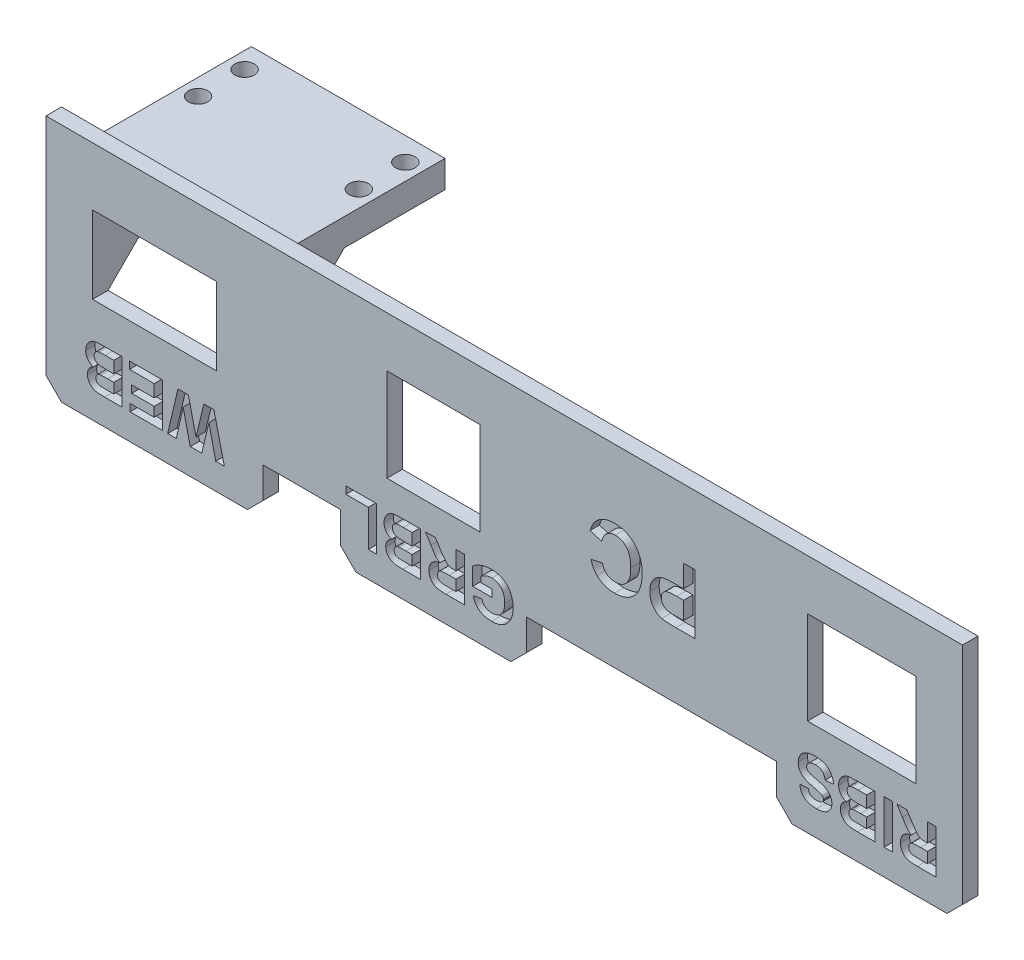
from build123d import *

# Parameters (mm, degrees)
SKETCH_1_W          = 80
SKETCH_1_H          = 25
EXTRUDE_1_DEPTH     = 2
SKETCH_2_W          = 14
SKETCH_2_H          = 12
CUT_EXTRUDE_2_DEPTH = 42.955333392
SKETCH_3_W          = 12
SKETCH_3_H          = 12
CUT_EXTRUDE_3_DEPTH = 42.955333392
SKETCH_4_W          = 40
SKETCH_4_H          = 25
EXTRUDE_2_DEPTH     = 2
SKETCH_5_W          = 16
SKETCH_5_H          = 10
CUT_EXTRUDE_4_DEPTH = 81.995370238
SKETCH_6_W          = 25
SKETCH_6_H          = 3.5
EXTRUDE_3_DEPTH     = 25
CHAMFER_1_SIZE      = 10
SKETCH_7_R          = 1.25
CUT_EXTRUDE_5_DEPTH = 86.060272748
SKETCH_8_W          = 10
SKETCH_8_H          = 12
EXTRUDE_4_DEPTH     = 1.5
SKETCH_9_W          = 2.78
SKETCH_9_H          = 25
EXTRUDE_5_DEPTH     = 2
CUT_EXTRUDE_6_DEPTH = 1.2
SKETCH_12_W         = 24
SKETCH_12_H         = 6
SKETCH_12_W_2       = 32.5
EXTRUDE_6_DEPTH     = 2
SKETCH_13_W         = 4.5
SKETCH_13_H         = 31
CUT_EXTRUDE_7_DEPTH = 89.429511026
CHAMFER_2_SIZE      = 2
SKETCH_14_W         = 1.086596367
SKETCH_14_H         = 5.650301107
CUT_EXTRUDE_9_DEPTH = 1.2


with BuildPart() as part:
    # Эскиз1 → Бобышка-Вытянуть1 (new body)
    with BuildSketch(Plane.XY):
        Rectangle(SKETCH_1_W, SKETCH_1_H)
    extrude(amount=EXTRUDE_1_DEPTH)

    # Эскиз2 → Вырез-Вытянуть2 (cut, through all)
    with BuildSketch(Plane.XY.offset(2)):
        with Locations((27, 0)):
            Rectangle(SKETCH_2_W, SKETCH_2_H)
    extrude(amount=-CUT_EXTRUDE_2_DEPTH, mode=Mode.SUBTRACT)

    # Эскиз3 → Вырез-Вытянуть3 (cut, through all)
    with BuildSketch(Plane(origin=(0, 0, 0), x_dir=(-1, 0, 0), z_dir=(0, 0, -1))):
        with Locations((28.28, 0)):
            Rectangle(SKETCH_3_W, SKETCH_3_H)
    extrude(amount=-CUT_EXTRUDE_3_DEPTH, mode=Mode.SUBTRACT)

    # Эскиз4 → Бобышка-Вытянуть2 (add)
    with BuildSketch(Plane(origin=(0, 0, 0), x_dir=(-1, 0, 0), z_dir=(0, 0, -1))):
        with Locations((60, 0)):
            Rectangle(SKETCH_4_W, SKETCH_4_H)
    extrude(amount=-EXTRUDE_2_DEPTH)

    # Эскиз5 → Вырез-Вытянуть4 (cut, through all)
    with BuildSketch(Plane(origin=(0, 0, 0), x_dir=(-1, 0, 0), z_dir=(0, 0, -1))):
        with Locations((64.28, 0)):
            Rectangle(SKETCH_5_W, SKETCH_5_H)
    extrude(amount=-CUT_EXTRUDE_4_DEPTH, mode=Mode.SUBTRACT)

    # Эскиз6 → Бобышка-Вытянуть3 (add)
    with BuildSketch(Plane.XY.offset(2)):
        with Locations((-64.28, 6.75)):
            Rectangle(SKETCH_6_W, SKETCH_6_H)
    extrude(amount=-EXTRUDE_3_DEPTH)

    # Фаска1
    chamfer_1_edges = [part.edges().sort_by_distance(p)[0] for p in [
        (-74.53, 5, 0),
        (-54.03, 5, 0),
    ]]
    chamfer(chamfer_1_edges, length=CHAMFER_1_SIZE)

    # Эскиз7 → Вырез-Вытянуть5 (cut, through all)
    with BuildSketch(Plane.XZ.offset(-5)):
        with Locations(Location((-53.908844125, -20, 0), (0, 0, 270))):
            Circle(SKETCH_7_R)
        with Locations(Location((-53.908844125, -14, 0), (0, 0, 270))):
            Circle(SKETCH_7_R)
        with Locations(Location((-74.651155875, -20, 0), (0, 0, 270))):
            Circle(SKETCH_7_R)
        with Locations(Location((-74.651155875, -14, 0), (0, 0, 270))):
            Circle(SKETCH_7_R)
    extrude(amount=-CUT_EXTRUDE_5_DEPTH, mode=Mode.SUBTRACT)

    # Эскиз8 → Бобышка-Вытянуть4 (add)
    with BuildSketch(Plane.XZ.offset(-5)):
        with Locations((-64.28, -17)):
            Rectangle(SKETCH_8_W, SKETCH_8_H)
    extrude(amount=EXTRUDE_4_DEPTH)

    # Эскиз9 → Бобышка-Вытянуть5 (add)
    with BuildSketch(Plane(origin=(0, 0, 0), x_dir=(-1, 0, 0), z_dir=(0, 0, -1))):
        with Locations((81.39, 0)):
            Rectangle(SKETCH_9_W, SKETCH_9_H)
    extrude(amount=-EXTRUDE_5_DEPTH)

    # Эскиз11 → Вырез-Вытянуть6 (cut)
    # profile 1 of 2: a face of its own
    with BuildSketch(Plane.XY.offset(2)):
        with BuildLine():
            Line((5.478359688, 3.65174682), (5.478359688, -4.053209235))
            Line((5.478359688, -4.053209235), (3.013452873, -4.053209235))
            add(Edge.make_bspline(
                [(3.013452873, -4.053209235), (2.800429774, -4.054102167), (2.495767017, -4.050088563), (2.109933438, -4.037234048), (1.865932436, -4.025769043), (1.652864321, -4.00880557), (1.428688509, -3.984467149), (1.276000636, -3.960835922), (1.185995347, -3.935906218)],
                knots=[0, 0, 0, 0, 0.348329602, 0.498164033, 0.631257919, 0.747723995, 0.847596688, 1, 1, 1, 1], degree=3))
            add(Edge.make_bspline(
                [(1.185995347, -3.935906218), (1.078043716, -3.908848967), (0.921817825, -3.850736874), (0.724210649, -3.749731505), (0.58450484, -3.659735466), (0.450099086, -3.558951146), (0.323853497, -3.444014248), (0.202732879, -3.316944859), (0.089370641, -3.177364462), (-0.015160121, -3.026091138), (-0.103863958, -2.862113363), (-0.180340645, -2.688294997), (-0.241325119, -2.503526524), (-0.291762845, -2.308893094), (-0.336042582, -2.027769285), (-0.352018509, -1.810614048), (-0.349748097, -1.662388536)],
                knots=[0, 0, 0, 0, 0.112518302, 0.168209323, 0.224431521, 0.280595752, 0.338142129, 0.397105015, 0.458213278, 0.520063291, 0.583016011, 0.646708179, 0.712116041, 0.779846095, 0.850080739, 1, 1, 1, 1], degree=3))
            add(Edge.make_bspline(
                [(-0.349748097, -1.662388536), (-0.352054646, -1.441176961), (-0.32196736, -1.120179825), (-0.213512135, -0.719048285), (-0.098587663, -0.45959524), (0.038546906, -0.227414251), (0.196240904, -0.022832742), (0.367128919, 0.159238307), (0.558273655, 0.309210806), (0.757385329, 0.434443859), (1.020090344, 0.574287736), (1.228617206, 0.644377018), (1.368123716, 0.675954497)],
                knots=[0, 0, 0, 0, 0.210527753, 0.305147016, 0.39443888, 0.479888845, 0.561317318, 0.639975034, 0.71702342, 0.791910697, 0.86378715, 1, 1, 1, 1], degree=3))
            add(Edge.make_bspline(
                [(1.368123716, 0.675954497), (1.470883991, 0.696178212), (1.63318923, 0.722039188), (1.861320537, 0.745033389), (2.055334419, 0.760370918), (2.265297315, 0.772439029), (2.575989609, 0.785703875), (2.816927399, 0.78639883), (2.982583658, 0.787083671)],
                knots=[0, 0, 0, 0, 0.193875999, 0.303996994, 0.424377093, 0.554127776, 0.693295956, 1, 1, 1, 1], degree=3))
            Line((2.982583658, 0.787083671), (3.99663737, 0.787083671))
            Line((3.99663737, 0.787083671), (3.99663737, 3.65174682))
            Line((3.99663737, 3.65174682), (5.478359688, 3.65174682))
        make_face()
        with BuildLine():
            Line((3.99663737, -2.769049892), (3.99663737, -0.497075671))
            Line((3.99663737, -0.497075671), (3.107603979, -0.497075671))
            add(Edge.make_bspline(
                [(3.107603979, -0.497075671), (2.960993299, -0.497150893), (2.750265776, -0.498563845), (2.483485142, -0.515203843), (2.312302846, -0.525612457), (2.162100132, -0.544767202), (2.031014855, -0.565524393), (1.920093975, -0.591332932), (1.799763362, -0.629569014), (1.670425359, -0.690320788), (1.532766574, -0.780334701), (1.412918258, -0.88922142), (1.312378208, -1.015017818), (1.231367858, -1.15415733), (1.153719038, -1.360328039), (1.130127248, -1.526522601), (1.131974221, -1.639236625)],
                knots=[0, 0, 0, 0, 0.168840534, 0.24240189, 0.307726277, 0.366204598, 0.416643548, 0.460461276, 0.497173933, 0.561831686, 0.624256186, 0.685891741, 0.747404803, 0.808969171, 0.870459417, 1, 1, 1, 1], degree=3))
            add(Edge.make_bspline(
                [(1.131974221, -1.639236625), (1.129548484, -1.774466511), (1.161277751, -1.973430835), (1.271105385, -2.212103965), (1.385516429, -2.363602299), (1.523173886, -2.49151677), (1.734268793, -2.631548416), (1.917235008, -2.691543085), (2.042616063, -2.715028766)],
                knots=[0, 0, 0, 0, 0.26321949, 0.386148679, 0.508700935, 0.630747428, 0.750908696, 1, 1, 1, 1], degree=3))
            add(Edge.make_bspline(
                [(2.042616063, -2.715028766), (2.102927461, -2.725673624), (2.203281943, -2.737135235), (2.349673541, -2.748294401), (2.487076841, -2.755864407), (2.642475077, -2.761758664), (2.886319652, -2.768904518), (3.078297819, -2.766806892), (3.21255931, -2.769049892)],
                knots=[0, 0, 0, 0, 0.156655451, 0.258348345, 0.375719036, 0.508809543, 0.656332343, 1, 1, 1, 1], degree=3))
            Line((3.21255931, -2.769049892), (3.99663737, -2.769049892))
        make_face(mode=Mode.SUBTRACT)
    # profile 2 of 2: a face of its own
    with BuildSketch(Plane.XY.offset(2)):
        with BuildLine():
            Line((-6.572981833, 0.787083671), (-8.054704152, 1.280991111))
            add(Edge.make_bspline(
                [(-8.054704152, 1.280991111), (-7.998555008, 1.471937397), (-7.901939419, 1.74952561), (-7.733904011, 2.094337667), (-7.596621706, 2.328520335), (-7.444442512, 2.542527355), (-7.279449225, 2.738528833), (-7.097558543, 2.913276784), (-6.902424044, 3.070007296), (-6.693081544, 3.207871438), (-6.469846422, 3.327081178), (-6.233119624, 3.427352702), (-5.982567665, 3.509162995), (-5.719128813, 3.574418995), (-5.341440611, 3.633622697), (-5.050186697, 3.652644814), (-4.852023099, 3.65174682)],
                knots=[0, 0, 0, 0, 0.137909663, 0.202924781, 0.265376309, 0.325682998, 0.384580708, 0.442536498, 0.500073488, 0.55768655, 0.615868613, 0.675098405, 0.73549134, 0.798229849, 0.862839507, 1, 1, 1, 1], degree=3))
            add(Edge.make_bspline(
                [(-4.852023099, 3.65174682), (-4.605833936, 3.653432427), (-4.242431981, 3.621784584), (-3.777218663, 3.512751465), (-3.450542698, 3.402038406), (-3.141951695, 3.255647882), (-2.85069766, 3.077577526), (-2.577149106, 2.866855295), (-2.321779683, 2.627393834), (-2.090302642, 2.359381453), (-1.88842698, 2.06514326), (-1.716690744, 1.748226115), (-1.577186791, 1.407053928), (-1.469298836, 1.042448075), (-1.364951054, 0.512203552), (-1.337375048, 0.098066776), (-1.337562976, -0.183753139)],
                knots=[0, 0, 0, 0, 0.126041097, 0.185857567, 0.244347414, 0.302332477, 0.360396495, 0.418837069, 0.478854544, 0.539381069, 0.599818648, 0.661238859, 0.723620663, 0.788224015, 0.855653754, 1, 1, 1, 1], degree=3))
            add(Edge.make_bspline(
                [(-1.337562976, -0.183753139), (-1.338134136, -0.480803195), (-1.3635875, -0.91628349), (-1.470036933, -1.472684189), (-1.574430683, -1.854099171), (-1.715383739, -2.207874206), (-1.882239756, -2.537705472), (-2.085559046, -2.838470758), (-2.314512299, -3.113365314), (-2.569929875, -3.357385781), (-2.84596409, -3.570546942), (-3.142048486, -3.749663375), (-3.456676706, -3.89830579), (-3.791381524, -4.011777677), (-4.272536262, -4.123977376), (-4.649515733, -4.149785685), (-4.904500765, -4.151990723)],
                knots=[0, 0, 0, 0, 0.147860689, 0.216120613, 0.281505407, 0.344235521, 0.405240655, 0.465004469, 0.52441051, 0.58287419, 0.640357287, 0.69754568, 0.754672197, 0.813103942, 0.873008409, 1, 1, 1, 1], degree=3))
            add(Edge.make_bspline(
                [(-4.904500765, -4.151990723), (-5.127393192, -4.149925741), (-5.456606652, -4.129217763), (-5.878168646, -4.038847544), (-6.171353118, -3.94541993), (-6.449553196, -3.828831988), (-6.79756799, -3.63335152), (-7.03288123, -3.447423484), (-7.176474986, -3.309261154)],
                knots=[0, 0, 0, 0, 0.269237394, 0.396244931, 0.519356603, 0.640090852, 0.759610598, 1, 1, 1, 1], degree=3))
            add(Edge.make_bspline(
                [(-7.176474986, -3.309261154), (-7.266383249, -3.225080186), (-7.388230548, -3.082671185), (-7.533715345, -2.874487792), (-7.634852934, -2.701884988), (-7.727674712, -2.515527694), (-7.842989812, -2.243504334), (-7.914787063, -2.028576214), (-7.955922664, -1.880016502)],
                knots=[0, 0, 0, 0, 0.223929846, 0.340378238, 0.462188223, 0.58789995, 0.719300613, 1, 1, 1, 1], degree=3))
            Line((-7.955922664, -1.880016502), (-6.474200346, -1.583672038))
            add(Edge.make_bspline(
                [(-6.474200346, -1.583672038), (-6.451567551, -1.679967675), (-6.407071216, -1.819617812), (-6.329002598, -1.996090761), (-6.257658685, -2.116382547), (-6.181939008, -2.231907319), (-6.092081352, -2.336717227), (-5.995730226, -2.436009257), (-5.888715483, -2.525273795), (-5.774106291, -2.605799122), (-5.653058463, -2.676642115), (-5.525275466, -2.735769419), (-5.391724045, -2.783113385), (-5.252847572, -2.822828347), (-5.055522255, -2.856468218), (-4.904041806, -2.87027545), (-4.801088895, -2.86783138)],
                knots=[0, 0, 0, 0, 0.129401266, 0.191502994, 0.252159567, 0.312316653, 0.372084051, 0.432575837, 0.493292221, 0.554213761, 0.615790888, 0.676667726, 0.738244853, 0.801163147, 0.865507532, 1, 1, 1, 1], degree=3))
            add(Edge.make_bspline(
                [(-4.801088895, -2.86783138), (-4.659662948, -2.869536596), (-4.452010551, -2.848751096), (-4.185637873, -2.787178655), (-4.000244187, -2.720132021), (-3.8259999, -2.633006872), (-3.660364725, -2.529513899), (-3.507560848, -2.404619368), (-3.363948463, -2.262443249), (-3.235214471, -2.097195594), (-3.121928697, -1.909536082), (-3.027979937, -1.6971304), (-2.951692941, -1.462120467), (-2.891677026, -1.203934979), (-2.832233093, -0.814248446), (-2.821623824, -0.507539904), (-2.819285294, -0.296425774)],
                knots=[0, 0, 0, 0, 0.114852437, 0.169049484, 0.221994742, 0.274766097, 0.32723799, 0.380498132, 0.434940153, 0.49127413, 0.550405841, 0.612775607, 0.679730962, 0.751082971, 0.828134719, 1, 1, 1, 1], degree=3))
            add(Edge.make_bspline(
                [(-2.819285294, -0.296425774), (-2.821656495, -0.073514331), (-2.831837894, 0.24964009), (-2.891916912, 0.660321296), (-2.950823164, 0.930587638), (-3.027978377, 1.175181859), (-3.122061425, 1.394231942), (-3.232101479, 1.588881923), (-3.362615906, 1.755807611), (-3.505874782, 1.899808111), (-3.658627286, 2.025569561), (-3.822405838, 2.131382832), (-3.995989688, 2.21874272), (-4.180804408, 2.284633362), (-4.444794167, 2.350023092), (-4.651625582, 2.368487523), (-4.79182813, 2.367587477)],
                knots=[0, 0, 0, 0, 0.177674264, 0.256758734, 0.330210817, 0.397712961, 0.460651267, 0.519748378, 0.575225846, 0.628818309, 0.681221634, 0.732470463, 0.783770027, 0.835606603, 0.888367416, 1, 1, 1, 1], degree=3))
            add(Edge.make_bspline(
                [(-4.79182813, 2.367587477), (-4.895914692, 2.366076755), (-5.051285592, 2.358309469), (-5.25116766, 2.31562766), (-5.393614107, 2.273984984), (-5.531146361, 2.22170365), (-5.66166097, 2.154645815), (-5.787727232, 2.077570673), (-5.906729055, 1.98724511), (-6.020259716, 1.885837196), (-6.123807395, 1.768635244), (-6.219852578, 1.638453972), (-6.307196358, 1.494428684), (-6.388678586, 1.337771139), (-6.483919425, 1.102788447), (-6.542632595, 0.916733971), (-6.572981833, 0.787083671)],
                knots=[0, 0, 0, 0, 0.12046088, 0.178740623, 0.235724111, 0.291792154, 0.348405626, 0.404978529, 0.462271107, 0.520759571, 0.580529381, 0.642578218, 0.707405436, 0.774920301, 0.846330275, 1, 1, 1, 1], degree=3))
        make_face()
    extrude(amount=-CUT_EXTRUDE_6_DEPTH, mode=Mode.SUBTRACT)

    # Эскиз12 → Бобышка-Вытянуть6 (add)
    with BuildSketch(Plane.XY.offset(2)):
        with Locations((28, -15.5)):
            Rectangle(SKETCH_12_W, SKETCH_12_H)
        with Locations((-28.28, -15.5)):
            Rectangle(SKETCH_12_W, SKETCH_12_H)
        with Locations((-66.53, -15.5)):
            Rectangle(SKETCH_12_W_2, SKETCH_12_H)
    extrude(amount=-EXTRUDE_6_DEPTH)

    # Эскиз13 → Вырез-Вытянуть7 (cut, through all)
    with BuildSketch(Plane.XY.offset(2)):
        with Locations((-80.53, -3)):
            Rectangle(SKETCH_13_W, SKETCH_13_H)
    extrude(amount=-CUT_EXTRUDE_7_DEPTH, mode=Mode.SUBTRACT)

    # Фаска2
    chamfer_2_edges = [part.edges().sort_by_distance(p)[0] for p in [
        (40, -18.5, 1),
        (16, -18.5, 1),
        (-16.28, -18.5, 1),
        (-40.28, -18.5, 1),
        (-50.28, -18.5, 1),
        (-78.28, -18.5, 1),
    ]]
    chamfer(chamfer_2_edges, length=CHAMFER_2_SIZE)

    # Эскиз14 → Вырез-Вытянуть9 (cut)
    # profile 1 of 11: a face of its own
    with BuildSketch(Plane.XY.offset(2)):
        with BuildLine():
            add(Edge.make_bspline(
                [(33.623136198, -10.782410087), (33.693264238, -10.880716199), (33.794851378, -11.020131193), (33.924541243, -11.195689492), (34.009369637, -11.303989592), (34.081658422, -11.399947587), (34.147951096, -11.478438876), (34.202905755, -11.544130526), (34.265318059, -11.609047013), (34.337307856, -11.676257131), (34.428085748, -11.738872839), (34.518411937, -11.79296373), (34.617767695, -11.831854256), (34.732335598, -11.859139845), (34.933692452, -11.885127943), (35.098900311, -11.891927393), (35.21794274, -11.890512007)],
                knots=[0, 0, 0, 0, 0.174866002, 0.249830473, 0.31605822, 0.374090993, 0.423761052, 0.464830962, 0.498066322, 0.55415278, 0.607062015, 0.657483699, 0.706286701, 0.760884302, 0.827646316, 1, 1, 1, 1], degree=3))
            Line((35.21794274, -11.890512007), (35.461295051, -11.890512007))
            Line((35.461295051, -11.890512007), (35.461295051, -9.5))
            Line((35.461295051, -9.5), (36.547891418, -9.5))
            Line((36.547891418, -9.5), (36.547891418, -15.150301107))
            Line((36.547891418, -15.150301107), (34.176621222, -15.150301107))
            add(Edge.make_bspline(
                [(34.176621222, -15.150301107), (34.037789594, -15.149590871), (33.836718593, -15.147853525), (33.579591916, -15.12967221), (33.40915453, -15.114902728), (33.253998612, -15.093181259), (33.113752443, -15.067677632), (32.988868067, -15.037536073), (32.877968317, -15.00204931), (32.77724231, -14.960475907), (32.68308223, -14.911999922), (32.59459821, -14.854772129), (32.510630246, -14.791196088), (32.430852387, -14.721101628), (32.357443785, -14.642653295), (32.289127655, -14.557013922), (32.225958462, -14.464897483), (32.17031058, -14.36671033), (32.119462302, -14.265605868), (32.078072502, -14.16050819), (32.043875078, -14.051912294), (32.016594907, -13.940054325), (31.990868175, -13.784395152), (31.98367804, -13.665118725), (31.984186678, -13.584923216)],
                knots=[0, 0, 0, 0, 0.134564938, 0.19465053, 0.249721971, 0.300282227, 0.346384104, 0.387788665, 0.424666182, 0.459084619, 0.493255628, 0.52712418, 0.561047925, 0.595230664, 0.629883197, 0.664993531, 0.701292162, 0.737973481, 0.774266589, 0.810854894, 0.847272973, 0.884511088, 0.922311938, 1, 1, 1, 1], degree=3))
            add(Edge.make_bspline(
                [(31.984186678, -13.584923216), (31.983471904, -13.48446665), (31.995631106, -13.336632207), (32.031221358, -13.145210984), (32.071364491, -13.011746908), (32.121351736, -12.884693027), (32.182405499, -12.764940092), (32.254463943, -12.651365665), (32.337892518, -12.545575358), (32.432357921, -12.447356341), (32.538392622, -12.358853898), (32.655296385, -12.279146116), (32.784024439, -12.210605183), (32.922363535, -12.150237929), (33.127170658, -12.082208643), (33.289461433, -12.048309577), (33.401289439, -12.030864037)],
                knots=[0, 0, 0, 0, 0.129370558, 0.190806849, 0.250676869, 0.308757523, 0.366623905, 0.423703961, 0.481896537, 0.540034196, 0.599076462, 0.659653679, 0.722117385, 0.786819453, 0.854039683, 1, 1, 1, 1], degree=3))
            add(Edge.make_bspline(
                [(33.401289439, -12.030864037), (33.29184529, -11.961890264), (33.138102391, -11.848887333), (32.954615766, -11.681189197), (32.851418679, -11.571990133), (32.774959986, -11.474206233), (32.71085207, -11.390469506), (32.643183233, -11.292843502), (32.571641967, -11.181819562), (32.492677415, -11.059589815), (32.378793253, -10.870914564), (32.292584175, -10.722073257), (32.234330216, -10.618288761)],
                knots=[0, 0, 0, 0, 0.209166393, 0.307622323, 0.401732901, 0.45166098, 0.508279267, 0.572256002, 0.643666983, 0.721858097, 0.807553445, 1, 1, 1, 1], degree=3))
            Line((32.234330216, -10.618288761), (31.549548131, -9.5))
            Line((31.549548131, -9.5), (32.819507635, -9.5))
            Line((32.819507635, -9.5), (33.623136198, -10.782410087))
        make_face()
        with BuildLine():
            add(Edge.make_bspline(
                [(33.674070402, -14.190474316), (33.709751387, -14.19518118), (33.772854372, -14.197960003), (33.868717722, -14.202427006), (33.967981766, -14.204055127), (34.08492673, -14.206809204), (34.276983894, -14.207599964), (34.429775731, -14.209524633), (34.53768814, -14.208584256)],
                knots=[0, 0, 0, 0, 0.124812716, 0.219210218, 0.333205091, 0.469464021, 0.625352362, 1, 1, 1, 1], degree=3))
            Line((34.53768814, -14.208584256), (35.461295051, -14.208584256))
            Line((35.461295051, -14.208584256), (35.461295051, -12.832228858))
            Line((35.461295051, -12.832228858), (34.586358602, -12.832228858))
            add(Edge.make_bspline(
                [(34.586358602, -12.832228858), (34.457667678, -12.831499045), (34.274705981, -12.835205134), (34.044091857, -12.83999342), (33.901139257, -12.848653048), (33.778020129, -12.85692838), (33.674890065, -12.867969485), (33.591613238, -12.880930527), (33.508439667, -12.901096453), (33.42321261, -12.936204286), (33.332498089, -12.986309449), (33.254325563, -13.051134432), (33.188435117, -13.127167027), (33.135568134, -13.214252379), (33.083845988, -13.348904605), (33.071348179, -13.459715198), (33.070783045, -13.535120883)],
                knots=[0, 0, 0, 0, 0.20221285, 0.287630068, 0.362456521, 0.427261522, 0.481544462, 0.525410475, 0.559637404, 0.615792278, 0.669701509, 0.721934669, 0.774479892, 0.82715543, 0.881220959, 1, 1, 1, 1], degree=3))
            add(Edge.make_bspline(
                [(33.070783045, -13.535120883), (33.071072813, -13.618892461), (33.087779732, -13.742330247), (33.155199373, -13.889039749), (33.22567018, -13.980801575), (33.314564099, -14.057525593), (33.460222862, -14.142180121), (33.586617177, -14.176416722), (33.674070402, -14.190474316)],
                knots=[0, 0, 0, 0, 0.256156175, 0.373042872, 0.488836402, 0.606316624, 0.729101171, 1, 1, 1, 1], degree=3))
        make_face(mode=Mode.SUBTRACT)
    # profile 2 of 11: a face of its own
    with BuildSketch(Plane.XY.offset(2)):
        with Locations((30.426731886, -12.325150554)):
            Rectangle(SKETCH_14_W, SKETCH_14_H)
    # profile 3 of 11: a face of its own
    with BuildSketch(Plane.XY.offset(2)):
        with BuildLine():
            add(Edge.make_bspline(
                [(25.441971053, -9.538483621), (25.506018808, -9.532795804), (25.614631221, -9.525032759), (25.776239683, -9.518934376), (25.93467947, -9.512913697), (26.118437414, -9.508590439), (26.413486657, -9.504344015), (26.647397939, -9.500505031), (26.811535224, -9.5)],
                knots=[0, 0, 0, 0, 0.140766497, 0.238315848, 0.354022328, 0.487866729, 0.640687248, 1, 1, 1, 1], degree=3))
            Line((26.811535224, -9.5), (28.724397578, -9.5))
            Line((28.724397578, -9.5), (28.724397578, -15.150301107))
            Line((28.724397578, -15.150301107), (26.448204564, -15.150301107))
            add(Edge.make_bspline(
                [(26.448204564, -15.150301107), (26.342571182, -15.149428256), (26.189322791, -15.149403758), (25.992413541, -15.142641098), (25.860689569, -15.137401866), (25.739901518, -15.129669187), (25.629751335, -15.119275729), (25.530496382, -15.108057838), (25.413073866, -15.092396114), (25.277554871, -15.061532046), (25.123777411, -15.010822695), (24.979012062, -14.944414681), (24.842416633, -14.864318216), (24.716339015, -14.76762455), (24.601781294, -14.655582564), (24.496524083, -14.530353203), (24.404439511, -14.390951766), (24.327555631, -14.239295146), (24.254744181, -14.019825023), (24.232890713, -13.845773483), (24.233132595, -13.72867086)],
                knots=[0, 0, 0, 0, 0.105849828, 0.153503139, 0.197393065, 0.237926645, 0.274751149, 0.308230158, 0.338006729, 0.393399127, 0.447190956, 0.499967767, 0.552674136, 0.605522646, 0.658720146, 0.712927424, 0.769122717, 0.825754939, 0.882774404, 1, 1, 1, 1], degree=3))
            add(Edge.make_bspline(
                [(24.233132595, -13.72867086), (24.231113257, -13.599619726), (24.259567678, -13.408457423), (24.344475473, -13.166343157), (24.435551135, -12.997932466), (24.546726309, -12.842357911), (24.724276567, -12.661217699), (24.882945066, -12.555036164), (24.998277537, -12.502854334)],
                knots=[0, 0, 0, 0, 0.253071659, 0.376770455, 0.502926827, 0.628360861, 0.751685122, 1, 1, 1, 1], degree=3))
            add(Edge.make_bspline(
                [(24.998277537, -12.502854334), (24.922249961, -12.478197423), (24.811416476, -12.43599839), (24.674250419, -12.361681875), (24.579556795, -12.300933412), (24.491038207, -12.233880287), (24.41127211, -12.158334122), (24.3356838, -12.07858394), (24.269322993, -11.990628954), (24.209256372, -11.898675295), (24.158268557, -11.801283798), (24.114118196, -11.700797206), (24.07719129, -11.596197519), (24.050880517, -11.486787068), (24.022381774, -11.334555451), (24.017418193, -11.21673498), (24.015813322, -11.137817649)],
                knots=[0, 0, 0, 0, 0.132556806, 0.195780264, 0.258216645, 0.318868125, 0.379477695, 0.440087264, 0.500738744, 0.56178533, 0.621918965, 0.682673484, 0.743575816, 0.805446126, 0.868974916, 1, 1, 1, 1], degree=3))
            add(Edge.make_bspline(
                [(24.015813322, -11.137817649), (24.016469774, -11.010010863), (24.037830345, -10.817314877), (24.112604294, -10.568861514), (24.190337248, -10.387219475), (24.286243155, -10.214768829), (24.401087899, -10.059166479), (24.531369675, -9.921291196), (24.678583211, -9.802735107), (24.843419701, -9.702937282), (25.094592279, -9.596352438), (25.300429906, -9.553486838), (25.441971053, -9.538483621)],
                knots=[0, 0, 0, 0, 0.162582481, 0.24472131, 0.329220549, 0.413446814, 0.495125958, 0.574555217, 0.654072855, 0.734809093, 0.818867038, 1, 1, 1, 1], degree=3))
        make_face()
        with BuildLine():
            add(Edge.make_bspline(
                [(25.102409689, -11.186488111), (25.101234865, -11.266851759), (25.11777101, -11.384305567), (25.17144274, -11.529268913), (25.228807676, -11.624332021), (25.302384827, -11.707313544), (25.389367254, -11.779846227), (25.491752726, -11.838747014), (25.58916795, -11.877791442), (25.681462698, -11.90339106), (25.770371656, -11.917688811), (25.876636006, -11.933133979), (26.001012725, -11.943309292), (26.142855955, -11.952899797), (26.367813979, -11.959334393), (26.545486665, -11.964381673), (26.670051322, -11.962951764)],
                knots=[0, 0, 0, 0, 0.120653416, 0.176517222, 0.231509374, 0.286606853, 0.342631866, 0.401131818, 0.46352173, 0.50000752, 0.544982488, 0.59883834, 0.661524398, 0.732611151, 0.812683588, 1, 1, 1, 1], degree=3))
            Line((26.670051322, -11.962951764), (27.637801211, -11.962951764))
            Line((27.637801211, -11.962951764), (27.637801211, -10.441716851))
            Line((27.637801211, -10.441716851), (26.52856742, -10.441716851))
            add(Edge.make_bspline(
                [(26.52856742, -10.441716851), (26.430443594, -10.439863078), (26.29050626, -10.443684454), (26.113876848, -10.445324155), (26.003370276, -10.450664781), (25.907879928, -10.45473447), (25.809844844, -10.460831243), (25.744372998, -10.470356684), (25.705697047, -10.476804859)],
                knots=[0, 0, 0, 0, 0.356994199, 0.509418466, 0.642709622, 0.759541115, 0.857263317, 1, 1, 1, 1], degree=3))
            add(Edge.make_bspline(
                [(25.705697047, -10.476804859), (25.621236611, -10.490347971), (25.500463628, -10.530828694), (25.357852468, -10.618794003), (25.267525838, -10.70179183), (25.19171315, -10.799849537), (25.120023334, -10.96013258), (25.101310754, -11.094533715), (25.102409689, -11.186488111)],
                knots=[0, 0, 0, 0, 0.250354711, 0.3692042, 0.489074932, 0.608392506, 0.730224765, 1, 1, 1, 1], degree=3))
        make_face(mode=Mode.SUBTRACT)
        with BuildLine():
            add(Edge.make_bspline(
                [(25.92301632, -14.189342445), (25.96665112, -14.194010317), (26.042563265, -14.19686239), (26.158054466, -14.201026643), (26.275764798, -14.204500736), (26.414618335, -14.206665969), (26.640999821, -14.207717854), (26.821340351, -14.20945376), (26.948491641, -14.208584256)],
                knots=[0, 0, 0, 0, 0.128239924, 0.222081178, 0.33797787, 0.472601944, 0.628175072, 1, 1, 1, 1], degree=3))
            Line((26.948491641, -14.208584256), (27.637801211, -14.208584256))
            Line((27.637801211, -14.208584256), (27.637801211, -12.904668616))
            Line((27.637801211, -12.904668616), (26.851150716, -12.904668616))
            add(Edge.make_bspline(
                [(26.851150716, -12.904668616), (26.745504406, -12.903820947), (26.595347268, -12.905523311), (26.405939836, -12.906611083), (26.288588488, -12.908728284), (26.187861093, -12.912290688), (26.087078032, -12.916412346), (26.019845969, -12.919395586), (25.980741752, -12.923910426)],
                knots=[0, 0, 0, 0, 0.363928509, 0.517301829, 0.652498452, 0.768239873, 0.864498693, 1, 1, 1, 1], degree=3))
            add(Edge.make_bspline(
                [(25.980741752, -12.923910426), (25.886735186, -12.935488184), (25.750293914, -12.964462728), (25.590581571, -13.046340704), (25.493796807, -13.122807921), (25.414588692, -13.212795026), (25.339061054, -13.357910346), (25.319754122, -13.481929271), (25.319728962, -13.565681405)],
                knots=[0, 0, 0, 0, 0.279096356, 0.404007084, 0.523952073, 0.639468663, 0.75348706, 1, 1, 1, 1], degree=3))
            add(Edge.make_bspline(
                [(25.319728962, -13.565681405), (25.318030204, -13.646416949), (25.336947791, -13.764125435), (25.401231057, -13.905257702), (25.468985153, -13.994757901), (25.55665162, -14.068809965), (25.703915415, -14.151233237), (25.834009517, -14.17690567), (25.92301632, -14.189342445)],
                knots=[0, 0, 0, 0, 0.250493583, 0.364336238, 0.479021292, 0.596291056, 0.718617035, 1, 1, 1, 1], degree=3))
        make_face(mode=Mode.SUBTRACT)
    # profile 4 of 11: a face of its own
    with BuildSketch(Plane.XY.offset(2)):
        with BuildLine():
            add(Edge.make_bspline(
                [(21.048046996, -9.427560242), (21.215621629, -9.427234395), (21.460272811, -9.441916589), (21.773604341, -9.493829187), (21.986786004, -9.547765039), (22.18405345, -9.619270393), (22.366203326, -9.705320789), (22.533488651, -9.806440717), (22.684385833, -9.924985031), (22.820685309, -10.058046854), (22.9429568, -10.204947076), (23.04900768, -10.366930494), (23.143061139, -10.541693185), (23.218880955, -10.732584903), (23.308155994, -11.010628415), (23.345028293, -11.232365342), (23.363855502, -11.383433702)],
                knots=[0, 0, 0, 0, 0.14822979, 0.216267066, 0.28070209, 0.342464382, 0.401582909, 0.458650721, 0.514999608, 0.570935808, 0.626873004, 0.683709045, 0.741939092, 0.802119253, 0.865134914, 1, 1, 1, 1], degree=3))
            Line((23.363855502, -11.383433702), (22.277259135, -11.45587346))
            add(Edge.make_bspline(
                [(22.277259135, -11.45587346), (22.262804386, -11.36710679), (22.230028936, -11.239850243), (22.173144346, -11.079033459), (22.124541089, -10.970968245), (22.068715794, -10.8724751), (22.00817132, -10.781801285), (21.938289665, -10.702685223), (21.862984334, -10.631683723), (21.781339652, -10.569001657), (21.69219791, -10.515730346), (21.596651986, -10.470386657), (21.494491648, -10.432739122), (21.384805502, -10.40471442), (21.226143001, -10.37730882), (21.102602981, -10.369573785), (21.018618344, -10.369277093)],
                knots=[0, 0, 0, 0, 0.146276166, 0.213513684, 0.277577704, 0.338920999, 0.397710006, 0.454752479, 0.510384706, 0.566047455, 0.621994268, 0.679152416, 0.738044055, 0.798989204, 0.863226787, 1, 1, 1, 1], degree=3))
            add(Edge.make_bspline(
                [(21.018618344, -10.369277093), (20.930482002, -10.368494028), (20.802334518, -10.375981538), (20.638137237, -10.399916597), (20.527753536, -10.426316611), (20.42577642, -10.458789279), (20.332104908, -10.498153596), (20.247452295, -10.546115864), (20.172053801, -10.601482509), (20.105810509, -10.661478523), (20.047036799, -10.723140519), (19.996906541, -10.787138756), (19.957052552, -10.855205634), (19.924916332, -10.924714999), (19.896209402, -11.022368578), (19.886356796, -11.098004989), (19.886747129, -11.149136361)],
                knots=[0, 0, 0, 0, 0.172383868, 0.250803066, 0.324406502, 0.394220361, 0.460047479, 0.522870364, 0.584155931, 0.64271227, 0.697552603, 0.750717255, 0.801366684, 0.851594613, 0.900178532, 1, 1, 1, 1], degree=3))
            add(Edge.make_bspline(
                [(19.886747129, -11.149136361), (19.888352312, -11.211474076), (19.898990397, -11.305853295), (19.951759679, -11.417545182), (20.003206886, -11.49514598), (20.076585619, -11.563948956), (20.210364939, -11.654908137), (20.330639467, -11.704222376), (20.416462857, -11.73544565)],
                knots=[0, 0, 0, 0, 0.221104653, 0.326256237, 0.432309136, 0.546855512, 0.677592017, 1, 1, 1, 1], degree=3))
            add(Edge.make_bspline(
                [(20.416462857, -11.73544565), (20.460028864, -11.75089012), (20.534732543, -11.771946778), (20.6448999, -11.804064578), (20.751644027, -11.833282719), (20.874610397, -11.864404718), (21.069368915, -11.916849412), (21.225007132, -11.952367045), (21.333278542, -11.981061704)],
                knots=[0, 0, 0, 0, 0.145969724, 0.24521644, 0.362649159, 0.495673358, 0.646052864, 1, 1, 1, 1], degree=3))
            add(Edge.make_bspline(
                [(21.333278542, -11.981061704), (21.476886659, -12.014619984), (21.682293132, -12.07391503), (21.942111274, -12.162465433), (22.113053187, -12.228737848), (22.266061063, -12.300067299), (22.439982805, -12.395013745), (22.55670026, -12.476390577), (22.624743599, -12.535678599)],
                knots=[0, 0, 0, 0, 0.312028664, 0.452185788, 0.580901778, 0.699867642, 0.809231716, 1, 1, 1, 1], degree=3))
            add(Edge.make_bspline(
                [(22.624743599, -12.535678599), (22.707433092, -12.610128638), (22.822833693, -12.728727663), (22.944741781, -12.908222739), (23.018875918, -13.046524085), (23.075846943, -13.191741437), (23.130722855, -13.395469202), (23.147404786, -13.554692852), (23.146536229, -13.661890459)],
                knots=[0, 0, 0, 0, 0.260864037, 0.384834792, 0.506941124, 0.627504104, 0.749213612, 1, 1, 1, 1], degree=3))
            add(Edge.make_bspline(
                [(23.146536229, -13.661890459), (23.147167744, -13.801508631), (23.116744698, -14.01137338), (23.015015734, -14.274931524), (22.929313846, -14.432793391), (22.845487226, -14.551938727), (22.776429793, -14.63791437), (22.699070988, -14.71655497), (22.616231444, -14.790735028), (22.526509018, -14.858865193), (22.429796475, -14.92054518), (22.327911684, -14.979446486), (22.179238352, -15.047044198), (21.978482295, -15.119187794), (21.617330982, -15.203207334), (21.330141361, -15.221823148), (21.132937337, -15.222740865)],
                knots=[0, 0, 0, 0, 0.146321936, 0.219577281, 0.295356349, 0.33399041, 0.372237653, 0.410847398, 0.449517904, 0.48876494, 0.528819242, 0.569745254, 0.612049731, 0.699898793, 0.792982466, 1, 1, 1, 1], degree=3))
            add(Edge.make_bspline(
                [(21.132937337, -15.222740865), (20.969953881, -15.223416441), (20.73270575, -15.210383543), (20.429422038, -15.163264309), (20.225249734, -15.113422647), (20.036928544, -15.04904884), (19.864092168, -14.97123227), (19.707194623, -14.879249235), (19.567903489, -14.77217394), (19.44380482, -14.654144247), (19.335548484, -14.525217985), (19.242724442, -14.387027646), (19.164714541, -14.239672956), (19.1035091, -14.082397209), (19.042207209, -13.855730745), (19.022466782, -13.677431318), (19.017470035, -13.556626436)],
                knots=[0, 0, 0, 0, 0.161085171, 0.23435176, 0.303093689, 0.368548233, 0.430801009, 0.490154571, 0.547886746, 0.604070845, 0.65912596, 0.713945638, 0.768328479, 0.823592867, 0.880407135, 1, 1, 1, 1], degree=3))
            Line((19.017470035, -13.556626436), (20.104066402, -13.484186678))
            add(Edge.make_bspline(
                [(20.104066402, -13.484186678), (20.114735999, -13.550886731), (20.137946797, -13.64692491), (20.178925687, -13.767820773), (20.214760299, -13.848351174), (20.254479983, -13.92189947), (20.301868079, -13.986824838), (20.352972744, -14.045226803), (20.409687343, -14.097114215), (20.474699201, -14.139799073), (20.544565456, -14.178913138), (20.622681375, -14.210382919), (20.707907957, -14.236396458), (20.800709243, -14.256334288), (20.938218396, -14.276991472), (21.045784747, -14.279461564), (21.119354882, -14.281024013)],
                knots=[0, 0, 0, 0, 0.140144301, 0.204813398, 0.264794365, 0.323009576, 0.378020768, 0.431308891, 0.484012079, 0.537034596, 0.592434958, 0.650051335, 0.711513287, 0.77728824, 0.846982688, 1, 1, 1, 1], degree=3))
            add(Edge.make_bspline(
                [(21.119354882, -14.281024013), (21.196375743, -14.280143592), (21.309232892, -14.276181762), (21.453837423, -14.254029183), (21.552799838, -14.233079129), (21.645165682, -14.204524118), (21.757474527, -14.159068574), (21.83474414, -14.114042394), (21.882236081, -14.080682808)],
                knots=[0, 0, 0, 0, 0.288592084, 0.421400511, 0.54715205, 0.666859264, 0.78276635, 1, 1, 1, 1], degree=3))
            add(Edge.make_bspline(
                [(21.882236081, -14.080682808), (21.937209029, -14.042404981), (22.032517124, -13.940555711), (22.059719957, -13.803973765), (22.059939862, -13.73772583)],
                knots=[0, 0, 0, 0, 0.502501839, 1, 1, 1, 1], degree=3))
            add(Edge.make_bspline(
                [(22.059939862, -13.73772583), (22.061382406, -13.674651489), (22.03003992, -13.545040092), (21.943901553, -13.443599984), (21.892422922, -13.401560079)],
                knots=[0, 0, 0, 0, 0.485260731, 1, 1, 1, 1], degree=3))
            add(Edge.make_bspline(
                [(21.892422922, -13.401560079), (21.848759135, -13.364341749), (21.766619863, -13.317952957), (21.641605821, -13.262454749), (21.521326357, -13.21641507), (21.382415688, -13.169167085), (21.224267601, -13.121485802), (21.04693237, -13.074783596), (20.855782035, -13.027430254), (20.661439132, -12.981500129), (20.476028006, -12.931097078), (20.303611412, -12.882000602), (20.145003117, -12.830528655), (19.99938216, -12.780423283), (19.867456423, -12.72896102), (19.748320912, -12.67884211), (19.609392346, -12.609927455), (19.45195192, -12.516564606), (19.286845443, -12.380914964), (19.141369889, -12.228417854), (19.038986065, -12.085450524), (18.969445958, -11.961917677), (18.924136131, -11.863068857), (18.885749234, -11.758591884), (18.853780947, -11.649006984), (18.830888533, -11.534104827), (18.804996772, -11.371638845), (18.800878785, -11.245763276), (18.800150762, -11.160455073)],
                knots=[0, 0, 0, 0, 0.041005318, 0.067459352, 0.098272173, 0.133509587, 0.17287705, 0.216938573, 0.265268252, 0.314387646, 0.360422632, 0.40332367, 0.443192059, 0.48023251, 0.513965135, 0.544936182, 0.573065399, 0.625373384, 0.676057049, 0.726110299, 0.776441787, 0.801932194, 0.827892608, 0.854483822, 0.881855514, 0.909823569, 0.938619056, 1, 1, 1, 1], degree=3))
            add(Edge.make_bspline(
                [(18.800150762, -11.160455073), (18.800426344, -11.080954503), (18.808930801, -10.962426921), (18.835902602, -10.807070246), (18.865545134, -10.69315475), (18.904549679, -10.581645237), (18.949359254, -10.471053103), (19.004356347, -10.363078946), (19.067373687, -10.257773722), (19.136846148, -10.155450907), (19.21548363, -10.060948721), (19.299296764, -9.971490016), (19.391283601, -9.890568654), (19.489436249, -9.815084415), (19.594284478, -9.745993119), (19.707061997, -9.685054694), (19.826427715, -9.630241165), (19.953502636, -9.583399591), (20.087371667, -9.540903138), (20.229340555, -9.506431701), (20.378434253, -9.476816579), (20.535234076, -9.454326677), (20.758908292, -9.432864487), (20.931030506, -9.428318917), (21.048046996, -9.427560242)],
                knots=[0, 0, 0, 0, 0.074523402, 0.111165398, 0.147718483, 0.184749495, 0.221868274, 0.259522657, 0.298230868, 0.336893788, 0.375350607, 0.413386942, 0.451726426, 0.490077333, 0.529423696, 0.56931811, 0.610161194, 0.652477643, 0.696226437, 0.741787157, 0.789381906, 0.838712069, 0.890247116, 1, 1, 1, 1], degree=3))
        make_face()
    # profile 5 of 11: a face of its own
    with BuildSketch(Plane.XY.offset(2)):
        with BuildLine():
            add(Edge.make_bspline(
                [(-20.746265191, -10.369277093), (-20.87011074, -10.369065087), (-21.057398203, -10.388347274), (-21.303387189, -10.448313507), (-21.486698894, -10.511928392), (-21.663573556, -10.586709962), (-21.880105884, -10.69681536), (-22.031496968, -10.791327653), (-22.122620589, -10.863904814)],
                knots=[0, 0, 0, 0, 0.249675039, 0.378190292, 0.510123722, 0.640779162, 0.765392719, 1, 1, 1, 1], degree=3))
            Line((-22.122620589, -10.863904814), (-22.122620589, -11.600752976))
            Line((-22.122620589, -11.600752976), (-20.746265191, -11.600752976))
            Line((-20.746265191, -11.600752976), (-20.746265191, -12.542469827))
            Line((-20.746265191, -12.542469827), (-23.209216955, -12.542469827))
            Line((-23.209216955, -12.542469827), (-23.209216955, -10.27306804))
            add(Edge.make_bspline(
                [(-23.209216955, -10.27306804), (-23.146698921, -10.21514921), (-23.046131066, -10.13089041), (-22.897629064, -10.030823369), (-22.774085657, -9.956069329), (-22.640515486, -9.884031495), (-22.497481896, -9.813684412), (-22.344731038, -9.7456699), (-22.128521685, -9.660661848), (-21.850864141, -9.566489291), (-21.399093978, -9.459481538), (-21.053550099, -9.427588959), (-20.824364305, -9.427560242)],
                knots=[0, 0, 0, 0, 0.099096021, 0.152131362, 0.208015064, 0.266887184, 0.328473713, 0.393263926, 0.461184623, 0.598483654, 0.733687105, 1, 1, 1, 1], degree=3))
            add(Edge.make_bspline(
                [(-20.824364305, -9.427560242), (-20.683097386, -9.428150594), (-20.473489639, -9.436950836), (-20.200937139, -9.477827218), (-20.005834212, -9.516310668), (-19.81853866, -9.569178849), (-19.637737558, -9.632038473), (-19.464791609, -9.708749801), (-19.297915394, -9.793792861), (-19.141052786, -9.892027597), (-18.991553474, -9.997425377), (-18.855021436, -10.116651878), (-18.726012053, -10.242696272), (-18.609924487, -10.381064876), (-18.500919191, -10.526877023), (-18.405673697, -10.685200208), (-18.318601838, -10.851060095), (-18.241679744, -11.023801572), (-18.176664268, -11.201974815), (-18.119696185, -11.38309427), (-18.072860822, -11.567769225), (-18.038487712, -11.756604521), (-18.002438858, -12.014935796), (-17.995116472, -12.212233839), (-17.993554395, -12.344392364)],
                knots=[0, 0, 0, 0, 0.092392207, 0.136751387, 0.180034458, 0.222273758, 0.263842642, 0.305030177, 0.345837267, 0.386143583, 0.425903079, 0.465247474, 0.504480434, 0.54366454, 0.583170112, 0.623347232, 0.664268158, 0.705555227, 0.746827565, 0.788163942, 0.829610502, 0.871252463, 0.913555058, 1, 1, 1, 1], degree=3))
            add(Edge.make_bspline(
                [(-17.993554395, -12.344392364), (-17.993328593, -12.486545483), (-18.004530936, -12.697211559), (-18.041749534, -12.972647384), (-18.08350395, -13.169976306), (-18.133487474, -13.362131669), (-18.197893114, -13.547578041), (-18.27052865, -13.728317427), (-18.35719867, -13.900957041), (-18.452617474, -14.06669236), (-18.560587078, -14.221944503), (-18.678997871, -14.367242275), (-18.806479204, -14.503911403), (-18.946925654, -14.628307007), (-19.148277751, -14.783913633), (-19.312023674, -14.885409572), (-19.427635225, -14.943168674)],
                knots=[0, 0, 0, 0, 0.136161137, 0.201852854, 0.266083198, 0.329302623, 0.391946889, 0.454040136, 0.515794699, 0.576864119, 0.637129058, 0.696746544, 0.756330046, 0.815979304, 0.876281093, 1, 1, 1, 1], degree=3))
            add(Edge.make_bspline(
                [(-19.427635225, -14.943168674), (-19.518976025, -14.991373313), (-19.664451441, -15.052140645), (-19.867805147, -15.116661408), (-20.031532128, -15.154379479), (-20.202665833, -15.184841689), (-20.446808253, -15.216455676), (-20.635293047, -15.221428964), (-20.763243259, -15.222740865)],
                knots=[0, 0, 0, 0, 0.224671021, 0.342652648, 0.464224723, 0.590262889, 0.721120801, 1, 1, 1, 1], degree=3))
            add(Edge.make_bspline(
                [(-20.763243259, -15.222740865), (-20.92683416, -15.222263941), (-21.166560766, -15.211865104), (-21.474416122, -15.163685399), (-21.685296588, -15.115490395), (-21.881987664, -15.053472212), (-22.06414766, -14.977240866), (-22.232895374, -14.888317295), (-22.385786612, -14.783141061), (-22.525928354, -14.667171716), (-22.652956272, -14.540268651), (-22.766916399, -14.402242976), (-22.867903221, -14.253792443), (-22.955049762, -14.094291204), (-23.056800909, -13.8653771), (-23.109317407, -13.68199832), (-23.136777198, -13.556626436)],
                knots=[0, 0, 0, 0, 0.154507723, 0.225880691, 0.293868156, 0.358517473, 0.420292614, 0.480038843, 0.538219152, 0.59512551, 0.651533794, 0.707437299, 0.763838838, 0.820740738, 0.878776993, 1, 1, 1, 1], degree=3))
            Line((-23.136777198, -13.556626436), (-22.050180831, -13.339307162))
            add(Edge.make_bspline(
                [(-22.050180831, -13.339307162), (-22.030508168, -13.410110578), (-21.993541558, -13.512822298), (-21.929913065, -13.641632518), (-21.874417266, -13.730060901), (-21.815433545, -13.814847631), (-21.746105401, -13.891196787), (-21.673176298, -13.964796296), (-21.591297057, -14.029856406), (-21.504064523, -14.088534675), (-21.412408385, -14.141440936), (-21.314271908, -14.184344627), (-21.21102651, -14.218878775), (-21.103175288, -14.248153042), (-20.948648613, -14.272863169), (-20.829642899, -14.282640438), (-20.748528933, -14.281024013)],
                knots=[0, 0, 0, 0, 0.126736957, 0.187876798, 0.24750054, 0.306757078, 0.365795068, 0.425180207, 0.48536992, 0.545858151, 0.606500332, 0.667709454, 0.730294849, 0.794246781, 0.860282149, 1, 1, 1, 1], degree=3))
            add(Edge.make_bspline(
                [(-20.748528933, -14.281024013), (-20.627121015, -14.279467178), (-20.448009223, -14.268780411), (-20.219628108, -14.217260132), (-20.061767268, -14.165341891), (-19.913220796, -14.098653886), (-19.776001508, -14.014757711), (-19.646691307, -13.918605094), (-19.528970204, -13.805755413), (-19.42221077, -13.679218465), (-19.329790431, -13.537485174), (-19.252854609, -13.381013646), (-19.189825038, -13.210589458), (-19.139698999, -13.026206024), (-19.092580761, -12.752348843), (-19.0793554, -12.537991025), (-19.080150762, -12.390799084)],
                knots=[0, 0, 0, 0, 0.127317881, 0.186832172, 0.244669667, 0.301064616, 0.356888044, 0.412745006, 0.469465526, 0.527226076, 0.585734188, 0.646152756, 0.709401601, 0.775714492, 0.845920581, 1, 1, 1, 1], degree=3))
            add(Edge.make_bspline(
                [(-19.080150762, -12.390799084), (-19.079934844, -12.232393047), (-19.091621195, -12.001656105), (-19.140787829, -11.707157808), (-19.19207629, -11.509284833), (-19.255532696, -11.326322938), (-19.335609473, -11.15950334), (-19.429097456, -11.008244808), (-19.537941644, -10.874133773), (-19.656813275, -10.754704561), (-19.785972857, -10.651447807), (-19.924527175, -10.564799233), (-20.071128881, -10.49289173), (-20.227227478, -10.437348185), (-20.451519816, -10.383548593), (-20.627236678, -10.36926352), (-20.746265191, -10.369277093)],
                knots=[0, 0, 0, 0, 0.16014576, 0.232866171, 0.301399938, 0.366527501, 0.428269379, 0.488051303, 0.545818128, 0.602442176, 0.658064844, 0.712551804, 0.767295689, 0.82277832, 0.879658586, 1, 1, 1, 1], degree=3))
        make_face()
    # profile 6 of 11: a face of its own
    with BuildSketch(Plane.XY.offset(2)):
        with BuildLine():
            Line((-24.295813322, -15.150301107), (-24.295813322, -9.5))
            Line((-24.295813322, -9.5), (-25.382409689, -9.5))
            Line((-25.382409689, -9.5), (-25.382409689, -11.890512007))
            Line((-25.382409689, -11.890512007), (-25.625762, -11.890512007))
            add(Edge.make_bspline(
                [(-27.220568542, -10.782410087), (-27.150440503, -10.880716199), (-27.048853362, -11.020131193), (-26.919163497, -11.195689492), (-26.834335103, -11.303989592), (-26.762046318, -11.399947587), (-26.695753644, -11.478438876), (-26.640798985, -11.544130526), (-26.578386681, -11.609047013), (-26.506396884, -11.676257131), (-26.415618992, -11.738872839), (-26.325292803, -11.79296373), (-26.225937045, -11.831854256), (-26.111369142, -11.859139845), (-25.910012289, -11.885127943), (-25.744804429, -11.891927393), (-25.625762, -11.890512007)],
                knots=[0, 0, 0, 0, 0.174866002, 0.249830473, 0.31605822, 0.374090993, 0.423761052, 0.464830962, 0.498066322, 0.55415278, 0.607062015, 0.657483699, 0.706286701, 0.760884302, 0.827646316, 1, 1, 1, 1], degree=3))
            Line((-27.220568542, -10.782410087), (-28.024197105, -9.5))
            Line((-28.024197105, -9.5), (-29.294156609, -9.5))
            Line((-29.294156609, -9.5), (-28.609374524, -10.618288761))
            add(Edge.make_bspline(
                [(-27.442415301, -12.030864037), (-27.55185945, -11.961890264), (-27.705602349, -11.848887333), (-27.889088974, -11.681189197), (-27.992286061, -11.571990133), (-28.068744754, -11.474206233), (-28.13285267, -11.390469506), (-28.200521507, -11.292843502), (-28.272062773, -11.181819562), (-28.351027325, -11.059589815), (-28.464911487, -10.870914564), (-28.551120565, -10.722073257), (-28.609374524, -10.618288761)],
                knots=[0, 0, 0, 0, 0.209166393, 0.307622323, 0.401732901, 0.45166098, 0.508279267, 0.572256002, 0.643666983, 0.721858097, 0.807553445, 1, 1, 1, 1], degree=3))
            add(Edge.make_bspline(
                [(-28.859518062, -13.584923216), (-28.860232836, -13.48446665), (-28.848073634, -13.336632207), (-28.812483382, -13.145210984), (-28.772340249, -13.011746908), (-28.722353004, -12.884693027), (-28.661299241, -12.764940092), (-28.589240797, -12.651365665), (-28.505812222, -12.545575358), (-28.411346819, -12.447356341), (-28.305312118, -12.358853898), (-28.188408355, -12.279146116), (-28.059680302, -12.210605183), (-27.921341205, -12.150237929), (-27.716534082, -12.082208643), (-27.554243307, -12.048309577), (-27.442415301, -12.030864037)],
                knots=[0, 0, 0, 0, 0.129370558, 0.190806849, 0.250676869, 0.308757523, 0.366623905, 0.423703961, 0.481896537, 0.540034196, 0.599076462, 0.659653679, 0.722117385, 0.786819453, 0.854039683, 1, 1, 1, 1], degree=3))
            add(Edge.make_bspline(
                [(-26.667083518, -15.150301107), (-26.805915146, -15.149590871), (-27.006986148, -15.147853525), (-27.264112824, -15.12967221), (-27.43455021, -15.114902728), (-27.589706128, -15.093181259), (-27.729952297, -15.067677632), (-27.854836674, -15.037536073), (-27.965736423, -15.00204931), (-28.06646243, -14.960475907), (-28.16062251, -14.911999922), (-28.24910653, -14.854772129), (-28.333074494, -14.791196088), (-28.412852353, -14.721101628), (-28.486260955, -14.642653295), (-28.554577085, -14.557013922), (-28.617746278, -14.464897483), (-28.67339416, -14.36671033), (-28.724242438, -14.265605868), (-28.765632238, -14.16050819), (-28.799829662, -14.051912294), (-28.827109833, -13.940054325), (-28.852836565, -13.784395152), (-28.8600267, -13.665118725), (-28.859518062, -13.584923216)],
                knots=[0, 0, 0, 0, 0.134564938, 0.19465053, 0.249721971, 0.300282227, 0.346384104, 0.387788665, 0.424666182, 0.459084619, 0.493255628, 0.52712418, 0.561047925, 0.595230664, 0.629883197, 0.664993531, 0.701292162, 0.737973481, 0.774266589, 0.810854894, 0.847272973, 0.884511088, 0.922311938, 1, 1, 1, 1], degree=3))
            Line((-26.667083518, -15.150301107), (-24.295813322, -15.150301107))
        make_face()
        with BuildLine():
            Line((-26.257346138, -12.832228858), (-25.382409689, -12.832228858))
            Line((-25.382409689, -12.832228858), (-25.382409689, -14.208584256))
            Line((-25.382409689, -14.208584256), (-26.306016601, -14.208584256))
            add(Edge.make_bspline(
                [(-26.730337134, -14.206734176), (-26.696803627, -14.207071537), (-26.55535834, -14.207743094), (-26.413929009, -14.209524633), (-26.306016601, -14.208584256)],
                knots=[0.508917816, 0.508917816, 0.508917816, 0.508917816, 0.625352362, 1, 1, 1, 1], degree=3))
            add(Edge.make_bspline(
                [(-26.730337134, -14.206734176), (-26.877397445, -14.211226823), (-27.02651528, -14.213361135), (-27.169634338, -14.190474316)],
                knots=[0.092959049, 0.092959049, 0.092959049, 0.092959049, 0.186526265, 0.186526265, 0.186526265, 0.186526265], degree=3))
            add(Edge.make_bspline(
                [(-27.772921696, -13.535120883), (-27.772631927, -13.618892461), (-27.755925008, -13.742330247), (-27.688505367, -13.889039749), (-27.61803456, -13.980801575), (-27.529140641, -14.057525593), (-27.383481878, -14.142180121), (-27.257087563, -14.176416722), (-27.169634338, -14.190474316)],
                knots=[0, 0, 0, 0, 0.256156175, 0.373042872, 0.488836402, 0.606316624, 0.729101171, 1, 1, 1, 1], degree=3))
            add(Edge.make_bspline(
                [(-26.257346138, -12.832228858), (-26.386037062, -12.831499045), (-26.568998759, -12.835205134), (-26.799612883, -12.83999342), (-26.942565483, -12.848653048), (-27.065684611, -12.85692838), (-27.168814675, -12.867969485), (-27.252091502, -12.880930527), (-27.335265073, -12.901096453), (-27.42049213, -12.936204286), (-27.511206651, -12.986309449), (-27.589379178, -13.051134432), (-27.655269623, -13.127167027), (-27.708136606, -13.214252379), (-27.759858752, -13.348904605), (-27.772356561, -13.459715198), (-27.772921696, -13.535120883)],
                knots=[0, 0, 0, 0, 0.20221285, 0.287630068, 0.362456521, 0.427261522, 0.481544462, 0.525410475, 0.559637404, 0.615792278, 0.669701509, 0.721934669, 0.774479892, 0.82715543, 0.881220959, 1, 1, 1, 1], degree=3))
        make_face(mode=Mode.SUBTRACT)
    # profile 7 of 11: a face of its own
    with BuildSketch(Plane.XY.offset(2)):
        with BuildLine():
            add(Edge.make_bspline(
                [(-33.228540953, -9.538483621), (-33.164493198, -9.532795804), (-33.055880786, -9.525032759), (-32.894272324, -9.518934376), (-32.735832537, -9.512913697), (-32.552074593, -9.508590439), (-32.257025349, -9.504344015), (-32.023114068, -9.500505031), (-31.858976783, -9.5)],
                knots=[0, 0, 0, 0, 0.140766497, 0.238315848, 0.354022328, 0.487866729, 0.640687248, 1, 1, 1, 1], degree=3))
            Line((-31.858976783, -9.5), (-29.946114429, -9.5))
            Line((-29.946114429, -9.5), (-29.946114429, -15.150301107))
            Line((-29.946114429, -15.150301107), (-32.222307443, -15.150301107))
            add(Edge.make_bspline(
                [(-32.222307443, -15.150301107), (-32.327940825, -15.149428256), (-32.481189215, -15.149403758), (-32.678098466, -15.142641098), (-32.809822438, -15.137401866), (-32.930610489, -15.129669187), (-33.040760672, -15.119275729), (-33.140015624, -15.108057838), (-33.257438141, -15.092396114), (-33.392957136, -15.061532046), (-33.546734596, -15.010822695), (-33.691499945, -14.944414681), (-33.828095374, -14.864318216), (-33.954172992, -14.76762455), (-34.068730713, -14.655582564), (-34.173987923, -14.530353203), (-34.266072496, -14.390951766), (-34.342956376, -14.239295146), (-34.415767826, -14.019825023), (-34.437621293, -13.845773483), (-34.437379411, -13.72867086)],
                knots=[0, 0, 0, 0, 0.105849828, 0.153503139, 0.197393065, 0.237926645, 0.274751149, 0.308230158, 0.338006729, 0.393399127, 0.447190956, 0.499967767, 0.552674136, 0.605522646, 0.658720146, 0.712927424, 0.769122717, 0.825754939, 0.882774404, 1, 1, 1, 1], degree=3))
            add(Edge.make_bspline(
                [(-34.437379411, -13.72867086), (-34.439398749, -13.599619726), (-34.410944329, -13.408457423), (-34.326036534, -13.166343157), (-34.234960871, -12.997932466), (-34.123785697, -12.842357911), (-33.946235439, -12.661217699), (-33.787566941, -12.555036164), (-33.67223447, -12.502854334)],
                knots=[0, 0, 0, 0, 0.253071659, 0.376770455, 0.502926827, 0.628360861, 0.751685122, 1, 1, 1, 1], degree=3))
            add(Edge.make_bspline(
                [(-33.67223447, -12.502854334), (-33.748262045, -12.478197423), (-33.85909553, -12.43599839), (-33.996261587, -12.361681875), (-34.090955212, -12.300933412), (-34.1794738, -12.233880287), (-34.259239896, -12.158334122), (-34.334828207, -12.07858394), (-34.401189013, -11.990628954), (-34.461255635, -11.898675295), (-34.51224345, -11.801283798), (-34.556393811, -11.700797206), (-34.593320717, -11.596197519), (-34.619631489, -11.486787068), (-34.648130233, -11.334555451), (-34.653093813, -11.21673498), (-34.654698685, -11.137817649)],
                knots=[0, 0, 0, 0, 0.132556806, 0.195780264, 0.258216645, 0.318868125, 0.379477695, 0.440087264, 0.500738744, 0.56178533, 0.621918965, 0.682673484, 0.743575816, 0.805446126, 0.868974916, 1, 1, 1, 1], degree=3))
            add(Edge.make_bspline(
                [(-34.654698685, -11.137817649), (-34.654042233, -11.010010863), (-34.632681662, -10.817314877), (-34.557907713, -10.568861514), (-34.480174759, -10.387219475), (-34.384268852, -10.214768829), (-34.269424107, -10.059166479), (-34.139142332, -9.921291196), (-33.991928796, -9.802735107), (-33.827092305, -9.702937282), (-33.575919727, -9.596352438), (-33.370082101, -9.553486838), (-33.228540953, -9.538483621)],
                knots=[0, 0, 0, 0, 0.162582481, 0.24472131, 0.329220549, 0.413446814, 0.495125958, 0.574555217, 0.654072855, 0.734809093, 0.818867038, 1, 1, 1, 1], degree=3))
        make_face()
        with BuildLine():
            add(Edge.make_bspline(
                [(-33.568102318, -11.186488111), (-33.569277142, -11.266851759), (-33.552740997, -11.384305567), (-33.499069266, -11.529268913), (-33.441704331, -11.624332021), (-33.36812718, -11.707313544), (-33.281144753, -11.779846227), (-33.178759281, -11.838747014), (-33.081344057, -11.877791442), (-32.989049308, -11.90339106), (-32.90014035, -11.917688811), (-32.793876001, -11.933133979), (-32.669499281, -11.943309292), (-32.527656052, -11.952899797), (-32.302698028, -11.959334393), (-32.125025342, -11.964381673), (-32.000460685, -11.962951764)],
                knots=[0, 0, 0, 0, 0.120653416, 0.176517222, 0.231509374, 0.286606853, 0.342631866, 0.401131818, 0.46352173, 0.50000752, 0.544982488, 0.59883834, 0.661524398, 0.732611151, 0.812683588, 1, 1, 1, 1], degree=3))
            Line((-32.000460685, -11.962951764), (-31.032710796, -11.962951764))
            Line((-31.032710796, -11.962951764), (-31.032710796, -10.441716851))
            Line((-31.032710796, -10.441716851), (-32.141944587, -10.441716851))
            add(Edge.make_bspline(
                [(-32.141944587, -10.441716851), (-32.240068413, -10.439863078), (-32.380005747, -10.443684454), (-32.556635158, -10.445324155), (-32.667141731, -10.450664781), (-32.762632079, -10.45473447), (-32.860667162, -10.460831243), (-32.926139008, -10.470356684), (-32.96481496, -10.476804859)],
                knots=[0, 0, 0, 0, 0.356994199, 0.509418466, 0.642709622, 0.759541115, 0.857263317, 1, 1, 1, 1], degree=3))
            add(Edge.make_bspline(
                [(-32.96481496, -10.476804859), (-33.049275396, -10.490347971), (-33.170048379, -10.530828694), (-33.312659539, -10.618794003), (-33.402986168, -10.70179183), (-33.478798857, -10.799849537), (-33.550488672, -10.96013258), (-33.569201253, -11.094533715), (-33.568102318, -11.186488111)],
                knots=[0, 0, 0, 0, 0.250354711, 0.3692042, 0.489074932, 0.608392506, 0.730224765, 1, 1, 1, 1], degree=3))
        make_face(mode=Mode.SUBTRACT)
        with BuildLine():
            add(Edge.make_bspline(
                [(-32.747495687, -14.189342445), (-32.703860887, -14.194010317), (-32.627948742, -14.19686239), (-32.512457541, -14.201026643), (-32.394747209, -14.204500736), (-32.255893672, -14.206665969), (-32.029512185, -14.207717854), (-31.849171655, -14.20945376), (-31.722020366, -14.208584256)],
                knots=[0, 0, 0, 0, 0.128239924, 0.222081178, 0.33797787, 0.472601944, 0.628175072, 1, 1, 1, 1], degree=3))
            Line((-31.722020366, -14.208584256), (-31.032710796, -14.208584256))
            Line((-31.032710796, -14.208584256), (-31.032710796, -12.904668616))
            Line((-31.032710796, -12.904668616), (-31.81936129, -12.904668616))
            add(Edge.make_bspline(
                [(-31.81936129, -12.904668616), (-31.9250076, -12.903820947), (-32.075164739, -12.905523311), (-32.264572171, -12.906611083), (-32.381923518, -12.908728284), (-32.482650914, -12.912290688), (-32.583433974, -12.916412346), (-32.650666038, -12.919395586), (-32.689770255, -12.923910426)],
                knots=[0, 0, 0, 0, 0.363928509, 0.517301829, 0.652498452, 0.768239873, 0.864498693, 1, 1, 1, 1], degree=3))
            add(Edge.make_bspline(
                [(-32.689770255, -12.923910426), (-32.783776821, -12.935488184), (-32.920218093, -12.964462728), (-33.079930436, -13.046340704), (-33.1767152, -13.122807921), (-33.255923314, -13.212795026), (-33.331450953, -13.357910346), (-33.350757885, -13.481929271), (-33.350783045, -13.565681405)],
                knots=[0, 0, 0, 0, 0.279096356, 0.404007084, 0.523952073, 0.639468663, 0.75348706, 1, 1, 1, 1], degree=3))
            add(Edge.make_bspline(
                [(-33.350783045, -13.565681405), (-33.352481803, -13.646416949), (-33.333564215, -13.764125435), (-33.269280949, -13.905257702), (-33.201526853, -13.994757901), (-33.113860386, -14.068809965), (-32.966596591, -14.151233237), (-32.83650249, -14.17690567), (-32.747495687, -14.189342445)],
                knots=[0, 0, 0, 0, 0.250493583, 0.364336238, 0.479021292, 0.596291056, 0.718617035, 1, 1, 1, 1], degree=3))
        make_face(mode=Mode.SUBTRACT)
    # profile 8 of 11: a face of its own
    with BuildSketch(Plane.XY.offset(2)):
        Polygon((-39.580602214, -9.5), (-35.596415536, -9.5), (-35.596415536, -15.150301107), (-36.683011902, -15.150301107), (-36.683011902, -10.441716851), (-39.580602214, -10.441716851), align=None)
    # profile 9 of 11: a face of its own
    with BuildSketch(Plane.XY.offset(2)):
        Polygon((-57.908696929, -9.5), (-56.613836259, -9.5), (-55.261250157, -15.150301107), (-56.375011432, -15.150301107), (-57.253343495, -11.26911471), (-58.182609763, -15.150301107), (-59.665361055, -15.150301107), (-60.585572353, -11.203466179), (-61.461640674, -15.150301107), (-62.577665692, -15.150301107), (-61.249980757, -9.5), (-59.904185882, -9.5), (-58.919457924, -13.724143375), align=None)
    # profile 10 of 11: a face of its own
    with BuildSketch(Plane.XY.offset(2)):
        Polygon((-67.503569221, -9.5), (-63.229623512, -9.5), (-63.229623512, -15.150301107), (-67.431129463, -15.150301107), (-67.431129463, -14.208584256), (-64.316219879, -14.208584256), (-64.316219879, -12.977108373), (-67.21381019, -12.977108373), (-67.21381019, -12.035391522), (-64.316219879, -12.035391522), (-64.316219879, -10.441716851), (-67.503569221, -10.441716851), align=None)
    # profile 11 of 11: a face of its own
    with BuildSketch(Plane.XY.offset(2)):
        with BuildLine():
            add(Edge.make_bspline(
                [(-71.727712597, -9.538483621), (-71.663664842, -9.532795804), (-71.555052429, -9.525032759), (-71.393443967, -9.518934376), (-71.235004181, -9.512913697), (-71.051246236, -9.508590439), (-70.756196993, -9.504344015), (-70.522285711, -9.500505031), (-70.358148426, -9.5)],
                knots=[0, 0, 0, 0, 0.140766497, 0.238315848, 0.354022328, 0.487866729, 0.640687248, 1, 1, 1, 1], degree=3))
            Line((-70.358148426, -9.5), (-68.445286072, -9.5))
            Line((-68.445286072, -9.5), (-68.445286072, -15.150301107))
            Line((-68.445286072, -15.150301107), (-70.721479086, -15.150301107))
            add(Edge.make_bspline(
                [(-70.721479086, -15.150301107), (-70.827112468, -15.149428256), (-70.980360859, -15.149403758), (-71.177270109, -15.142641098), (-71.308994081, -15.137401866), (-71.429782132, -15.129669187), (-71.539932315, -15.119275729), (-71.639187268, -15.108057838), (-71.756609784, -15.092396114), (-71.892128779, -15.061532046), (-72.045906239, -15.010822695), (-72.190671588, -14.944414681), (-72.327267017, -14.864318216), (-72.453344635, -14.76762455), (-72.567902356, -14.655582564), (-72.673159567, -14.530353203), (-72.765244139, -14.390951766), (-72.842128019, -14.239295146), (-72.914939469, -14.019825023), (-72.936792937, -13.845773483), (-72.936551055, -13.72867086)],
                knots=[0, 0, 0, 0, 0.105849828, 0.153503139, 0.197393065, 0.237926645, 0.274751149, 0.308230158, 0.338006729, 0.393399127, 0.447190956, 0.499967767, 0.552674136, 0.605522646, 0.658720146, 0.712927424, 0.769122717, 0.825754939, 0.882774404, 1, 1, 1, 1], degree=3))
            add(Edge.make_bspline(
                [(-72.936551055, -13.72867086), (-72.938570393, -13.599619726), (-72.910115972, -13.408457423), (-72.825208177, -13.166343157), (-72.734132515, -12.997932466), (-72.622957341, -12.842357911), (-72.445407083, -12.661217699), (-72.286738584, -12.555036164), (-72.171406113, -12.502854334)],
                knots=[0, 0, 0, 0, 0.253071659, 0.376770455, 0.502926827, 0.628360861, 0.751685122, 1, 1, 1, 1], degree=3))
            add(Edge.make_bspline(
                [(-72.171406113, -12.502854334), (-72.247433689, -12.478197423), (-72.358267174, -12.43599839), (-72.495433231, -12.361681875), (-72.590126855, -12.300933412), (-72.678645443, -12.233880287), (-72.75841154, -12.158334122), (-72.83399985, -12.07858394), (-72.900360657, -11.990628954), (-72.960427278, -11.898675295), (-73.011415093, -11.801283798), (-73.055565454, -11.700797206), (-73.09249236, -11.596197519), (-73.118803133, -11.486787068), (-73.147301877, -11.334555451), (-73.152265457, -11.21673498), (-73.153870328, -11.137817649)],
                knots=[0, 0, 0, 0, 0.132556806, 0.195780264, 0.258216645, 0.318868125, 0.379477695, 0.440087264, 0.500738744, 0.56178533, 0.621918965, 0.682673484, 0.743575816, 0.805446126, 0.868974916, 1, 1, 1, 1], degree=3))
            add(Edge.make_bspline(
                [(-73.153870328, -11.137817649), (-73.153213876, -11.010010863), (-73.131853305, -10.817314877), (-73.057079356, -10.568861514), (-72.979346402, -10.387219475), (-72.883440495, -10.214768829), (-72.768595751, -10.059166479), (-72.638313975, -9.921291196), (-72.49110044, -9.802735107), (-72.326263949, -9.702937282), (-72.075091371, -9.596352438), (-71.869253744, -9.553486838), (-71.727712597, -9.538483621)],
                knots=[0, 0, 0, 0, 0.162582481, 0.24472131, 0.329220549, 0.413446814, 0.495125958, 0.574555217, 0.654072855, 0.734809093, 0.818867038, 1, 1, 1, 1], degree=3))
        make_face()
        with BuildLine():
            add(Edge.make_bspline(
                [(-72.067273961, -11.186488111), (-72.068448785, -11.266851759), (-72.051912641, -11.384305567), (-71.99824091, -11.529268913), (-71.940875974, -11.624332021), (-71.867298823, -11.707313544), (-71.780316396, -11.779846227), (-71.677930924, -11.838747014), (-71.5805157, -11.877791442), (-71.488220952, -11.90339106), (-71.399311994, -11.917688811), (-71.293047644, -11.933133979), (-71.168670925, -11.943309292), (-71.026827695, -11.952899797), (-70.801869671, -11.959334393), (-70.624196985, -11.964381673), (-70.499632328, -11.962951764)],
                knots=[0, 0, 0, 0, 0.120653416, 0.176517222, 0.231509374, 0.286606853, 0.342631866, 0.401131818, 0.46352173, 0.50000752, 0.544982488, 0.59883834, 0.661524398, 0.732611151, 0.812683588, 1, 1, 1, 1], degree=3))
            Line((-70.499632328, -11.962951764), (-69.531882439, -11.962951764))
            Line((-69.531882439, -11.962951764), (-69.531882439, -10.441716851))
            Line((-69.531882439, -10.441716851), (-70.64111623, -10.441716851))
            add(Edge.make_bspline(
                [(-70.64111623, -10.441716851), (-70.739240056, -10.439863078), (-70.87917739, -10.443684454), (-71.055806802, -10.445324155), (-71.166313374, -10.450664781), (-71.261803722, -10.45473447), (-71.359838806, -10.460831243), (-71.425310652, -10.470356684), (-71.463986604, -10.476804859)],
                knots=[0, 0, 0, 0, 0.356994199, 0.509418466, 0.642709622, 0.759541115, 0.857263317, 1, 1, 1, 1], degree=3))
            add(Edge.make_bspline(
                [(-71.463986604, -10.476804859), (-71.54844704, -10.490347971), (-71.669220022, -10.530828694), (-71.811831182, -10.618794003), (-71.902157812, -10.70179183), (-71.9779705, -10.799849537), (-72.049660316, -10.96013258), (-72.068372896, -11.094533715), (-72.067273961, -11.186488111)],
                knots=[0, 0, 0, 0, 0.250354711, 0.3692042, 0.489074932, 0.608392506, 0.730224765, 1, 1, 1, 1], degree=3))
        make_face(mode=Mode.SUBTRACT)
        with BuildLine():
            add(Edge.make_bspline(
                [(-71.24666733, -14.189342445), (-71.20303253, -14.194010317), (-71.127120385, -14.19686239), (-71.011629184, -14.201026643), (-70.893918852, -14.204500736), (-70.755065315, -14.206665969), (-70.528683829, -14.207717854), (-70.348343299, -14.20945376), (-70.221192009, -14.208584256)],
                knots=[0, 0, 0, 0, 0.128239924, 0.222081178, 0.33797787, 0.472601944, 0.628175072, 1, 1, 1, 1], degree=3))
            Line((-70.221192009, -14.208584256), (-69.531882439, -14.208584256))
            Line((-69.531882439, -14.208584256), (-69.531882439, -12.904668616))
            Line((-69.531882439, -12.904668616), (-70.318532934, -12.904668616))
            add(Edge.make_bspline(
                [(-70.318532934, -12.904668616), (-70.424179244, -12.903820947), (-70.574336382, -12.905523311), (-70.763743814, -12.906611083), (-70.881095162, -12.908728284), (-70.981822557, -12.912290688), (-71.082605618, -12.916412346), (-71.149837681, -12.919395586), (-71.188941898, -12.923910426)],
                knots=[0, 0, 0, 0, 0.363928509, 0.517301829, 0.652498452, 0.768239873, 0.864498693, 1, 1, 1, 1], degree=3))
            add(Edge.make_bspline(
                [(-71.188941898, -12.923910426), (-71.282948464, -12.935488184), (-71.419389736, -12.964462728), (-71.579102079, -13.046340704), (-71.675886843, -13.122807921), (-71.755094958, -13.212795026), (-71.830622596, -13.357910346), (-71.849929528, -13.481929271), (-71.849954688, -13.565681405)],
                knots=[0, 0, 0, 0, 0.279096356, 0.404007084, 0.523952073, 0.639468663, 0.75348706, 1, 1, 1, 1], degree=3))
            add(Edge.make_bspline(
                [(-71.849954688, -13.565681405), (-71.851653446, -13.646416949), (-71.832735859, -13.764125435), (-71.768452593, -13.905257702), (-71.700698497, -13.994757901), (-71.61303203, -14.068809965), (-71.465768235, -14.151233237), (-71.335674133, -14.17690567), (-71.24666733, -14.189342445)],
                knots=[0, 0, 0, 0, 0.250493583, 0.364336238, 0.479021292, 0.596291056, 0.718617035, 1, 1, 1, 1], degree=3))
        make_face(mode=Mode.SUBTRACT)
    extrude(amount=-CUT_EXTRUDE_9_DEPTH, mode=Mode.SUBTRACT)


solid = part.part
